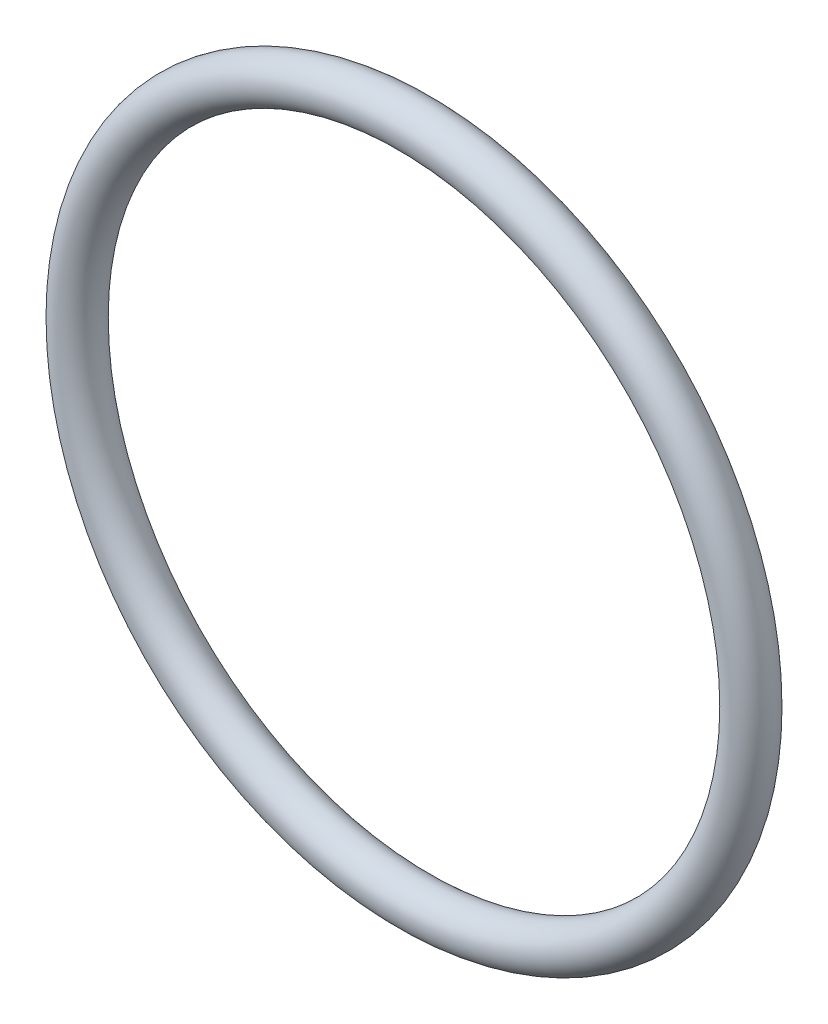
from build123d import *

# Parameters (mm, degrees)
SKETCH1_R = 1.27


with BuildPart() as part:
    # Sketch1 → Revolve1 (revolve)
    with BuildSketch(Plane(origin=(0, 0, 0), x_dir=(1, 0, 0), z_dir=(0, 1, 0)), mode=Mode.PRIVATE) as revolve1_sk:
        with Locations((19.431, 0)):
            Circle(SKETCH1_R)
    revolve(revolve1_sk.sketch.rotate(Axis((0, 0, -34.873120959), (0, 0, 1)), 180), axis=Axis((0, 0, -34.873120959), (0, 0, 1)))


solid = part.part
